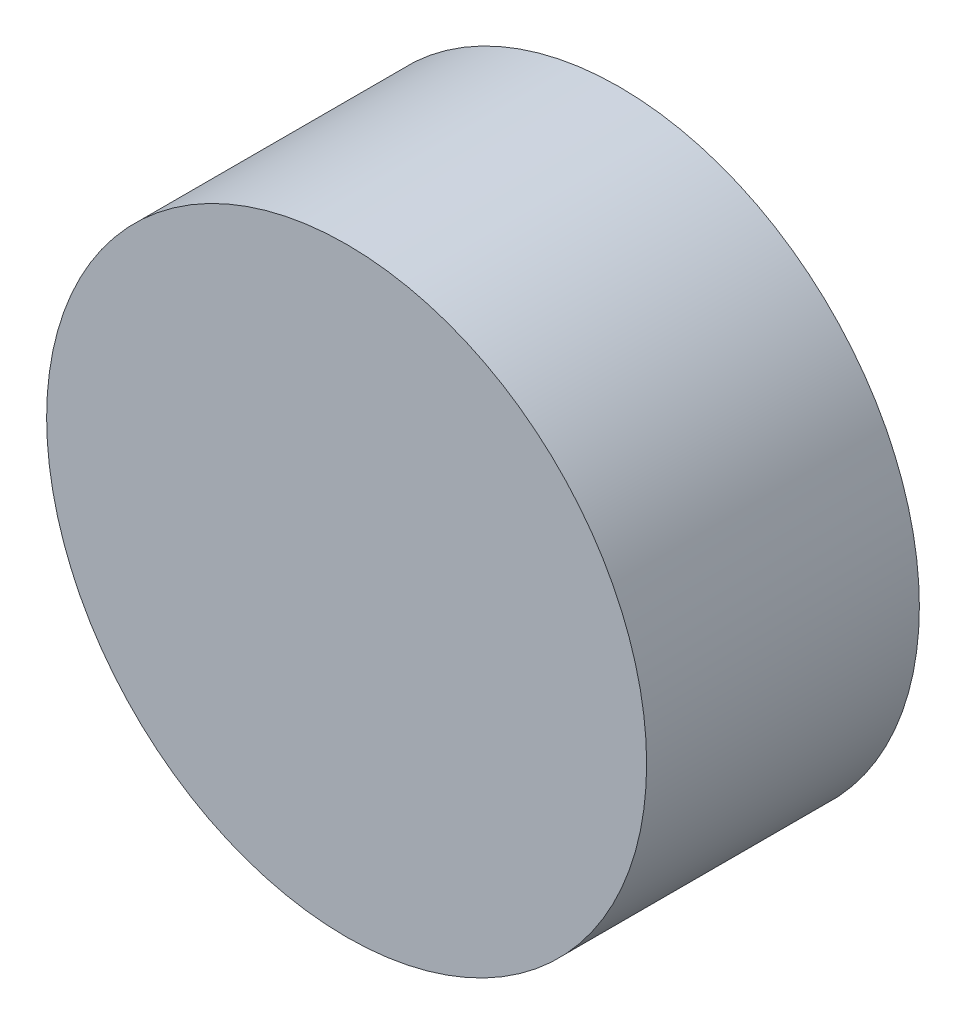
from build123d import *

# Parameters (mm, degrees)
SKETCH_1_R      = 22
EXTRUDE_1_DEPTH = 20


with BuildPart() as part:
    # 草图1 → 凸台-拉伸1 (new body)
    with BuildSketch(Plane.XY):
        Circle(SKETCH_1_R)
    extrude(amount=EXTRUDE_1_DEPTH)


solid = part.part
